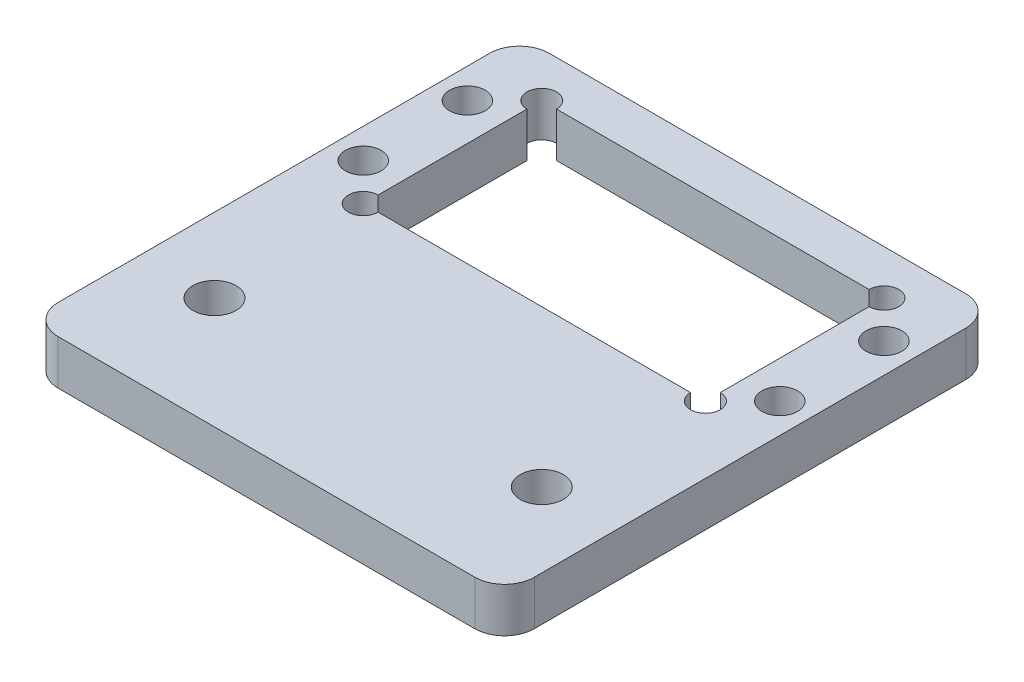
from build123d import *

# Parameters (mm, degrees)
SKETCH_1_W          = 32
SKETCH_1_H          = 18
SKETCH_1_R          = 1.2
SKETCH_1_W_2        = 23
SKETCH_1_H_2        = 12
EXTRUDE_1_DEPTH     = 3
CUT_EXTRUDE_1_REACH = 20.601
SKETCH_2_R          = 1
SKETCH_4_W          = 32
SKETCH_4_H          = 15
SKETCH_4_R          = 1.45
EXTRUDE_2_DEPTH     = 3
FILLET_1_R          = 2


with BuildPart() as part:
    # 草图1 → 凸台-拉伸1 (new body)
    with BuildSketch(Plane(origin=(0, 0, 0), x_dir=(1, 0, 0), z_dir=(0, 1, 0))):
        Rectangle(SKETCH_1_W, SKETCH_1_H)
        with Locations(Location((-14, 3.5, 0), (0, 0, 270))):
            Circle(SKETCH_1_R, mode=Mode.SUBTRACT)
        with Locations(Location((-14, -3.5, 0), (0, 0, 270))):
            Circle(SKETCH_1_R, mode=Mode.SUBTRACT)
        with Locations(Location((14, 3.5, 0), (0, 0, 270))):
            Circle(SKETCH_1_R, mode=Mode.SUBTRACT)
        with Locations(Location((14, -3.5, 0), (0, 0, 270))):
            Circle(SKETCH_1_R, mode=Mode.SUBTRACT)
        Rectangle(SKETCH_1_W_2, SKETCH_1_H_2, mode=Mode.SUBTRACT)
    extrude(amount=EXTRUDE_1_DEPTH)

    # 草图2 → 切除-拉伸1 (cut, up to next)
    with BuildSketch(Plane(origin=(0, 3, 0), x_dir=(1, 0, 0), z_dir=(0, 1, 0)), mode=Mode.PRIVATE) as cut_extrude_1_sk1:
        with Locations((-11.5, 6)):
            Circle(SKETCH_2_R)
    cut_extrude_1_tool1 = extrude(cut_extrude_1_sk1.sketch, amount=-CUT_EXTRUDE_1_REACH, mode=Mode.PRIVATE) & part.part
    # 草图2 → 切除-拉伸1 (cut, up to next)
    with BuildSketch(Plane(origin=(0, 3, 0), x_dir=(1, 0, 0), z_dir=(0, 1, 0)), mode=Mode.PRIVATE) as cut_extrude_1_sk2:
        with Locations((-11.5, -6)):
            Circle(SKETCH_2_R)
    cut_extrude_1_tool2 = extrude(cut_extrude_1_sk2.sketch, amount=-CUT_EXTRUDE_1_REACH, mode=Mode.PRIVATE) & part.part
    # 草图2 → 切除-拉伸1 (cut, up to next)
    with BuildSketch(Plane(origin=(0, 3, 0), x_dir=(1, 0, 0), z_dir=(0, 1, 0)), mode=Mode.PRIVATE) as cut_extrude_1_sk3:
        with Locations((11.5, -6)):
            Circle(SKETCH_2_R)
    cut_extrude_1_tool3 = extrude(cut_extrude_1_sk3.sketch, amount=-CUT_EXTRUDE_1_REACH, mode=Mode.PRIVATE) & part.part
    # 草图2 → 切除-拉伸1 (cut, up to next)
    with BuildSketch(Plane(origin=(0, 3, 0), x_dir=(1, 0, 0), z_dir=(0, 1, 0)), mode=Mode.PRIVATE) as cut_extrude_1_sk4:
        with Locations((11.5, 6)):
            Circle(SKETCH_2_R)
    cut_extrude_1_tool4 = extrude(cut_extrude_1_sk4.sketch, amount=-CUT_EXTRUDE_1_REACH, mode=Mode.PRIVATE) & part.part
    add(cut_extrude_1_tool1.solids().sort_by_distance((-11.5, 3, -6))[0], mode=Mode.SUBTRACT)
    add(cut_extrude_1_tool2.solids().sort_by_distance((-11.5, 3, 6))[0], mode=Mode.SUBTRACT)
    add(cut_extrude_1_tool3.solids().sort_by_distance((11.5, 3, 6))[0], mode=Mode.SUBTRACT)
    add(cut_extrude_1_tool4.solids().sort_by_distance((11.5, 3, -6))[0], mode=Mode.SUBTRACT)

    # 草图4 → 凸台-拉伸2 (add)
    with BuildSketch(Plane(origin=(0, 3, 0), x_dir=(1, 0, 0), z_dir=(0, 1, 0))):
        with Locations((0, -16.5)):
            Rectangle(SKETCH_4_W, SKETCH_4_H)
        with Locations(Location((-11, -16.5, 0), (0, 0, 270))):
            Circle(SKETCH_4_R, mode=Mode.SUBTRACT)
        with Locations(Location((11, -16.5, 0), (0, 0, 270))):
            Circle(SKETCH_4_R, mode=Mode.SUBTRACT)
    extrude(amount=-EXTRUDE_2_DEPTH)

    # 圆角1
    fillet_1_edges = [part.edges().sort_by_distance(p)[0] for p in [
        (-16, 1.5, -9),
        (16, 1.5, -9),
        (-16, 1.5, 24),
        (16, 1.5, 24),
    ]]
    fillet(fillet_1_edges, radius=FILLET_1_R)


solid = part.part
